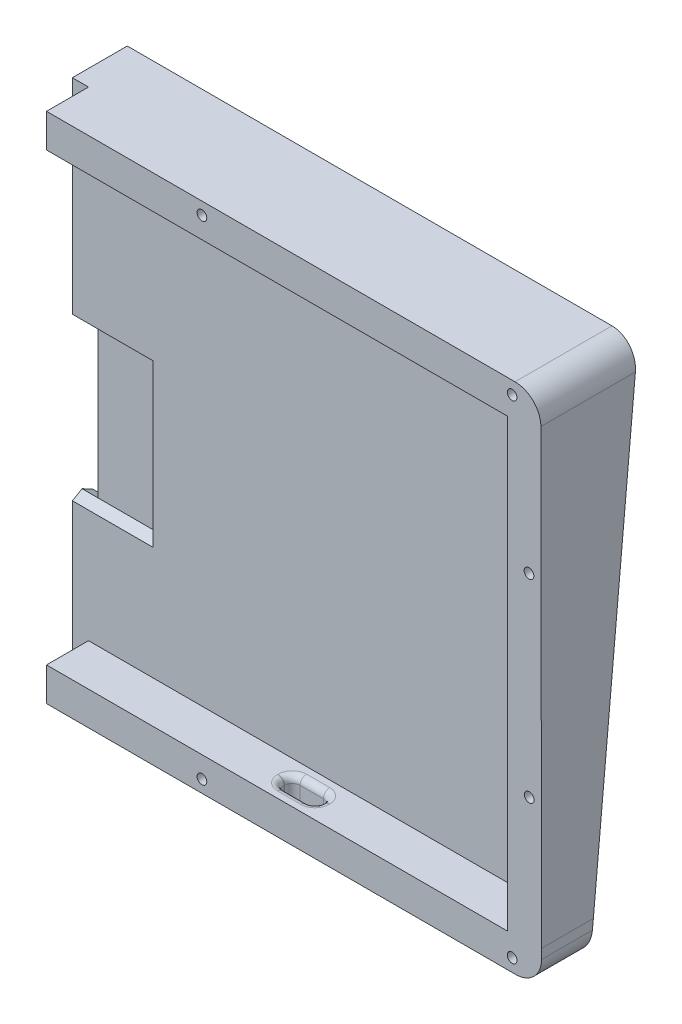
from build123d import *

# Parameters (mm, degrees)
EXTRUDE_1_DEPTH      = 30
SKETCH_2_R           = 1.5
CUT_EXTRUDE_1_DEPTH  = 5
CUT_EXTRUDE_4_DEPTH  = 307
SKETCH_3_W           = 285.26
SKETCH_3_H           = 138.01
CUT_EXTRUDE_5_DEPTH  = 13
SKETCH_12_W          = 40
SKETCH_12_H          = 50
CUT_EXTRUDE_7_DEPTH  = 3
CUT_EXTRUDE_7_DRAFT  = -30
SKETCH_9_W           = 100
SKETCH_9_H           = 80
CUT_EXTRUDE_8_DEPTH  = 3
CUT_EXTRUDE_8_DRAFT  = -30
CUT_EXTRUDE_9_DEPTH  = 11
FILLET_1_R           = 2
CUT_EXTRUDE_10_DEPTH = 11
FILLET_2_R           = 2
FILLET_3_R           = 2
FILLET_4_R           = 2
EXTRUDE_3_DEPTH      = 5
EXTRUDE_4_DEPTH      = 5


with BuildPart() as part:
    # Model → 凸台-拉伸1 (new body)
    with BuildSketch(Plane.XY):
        with BuildLine():
            Line((0, 11), (0, 150.75))
            ThreePointArc((0, 150.75), (2.343145751, 156.406854249), (8, 158.75))
            Line((8, 158.75), (298.011203897, 158.75))
            ThreePointArc((298.011203897, 158.75), (303.664092807, 156.410816811), (306.011196041, 150.761211743))
            Line((306.011196041, 150.761211743), (306.207051361, 11.011211743))
            Line((306.207051361, 11.011211743), (306.207051361, 8))
            ThreePointArc((306.207051361, 8), (303.863905611, 2.343145751), (298.207051361, 0))
            Line((298.207051361, 0), (8, 0))
            ThreePointArc((8, 0), (2.343145751, 2.343145751), (0, 8))
            Line((0, 8), (0, 11))
        make_face()
    extrude(amount=-EXTRUDE_1_DEPTH)

    # 草图2 → 切除-拉伸1 (cut)
    with BuildSketch(Plane.XY):
        with Locations((105.108569936, 3.75)):
            Circle(SKETCH_2_R)
        with Locations((9.108569936, 3.75)):
            Circle(SKETCH_2_R)
        with Locations((201.10846029, 3.817270412)):
            Circle(SKETCH_2_R)
        with Locations((297.108366012, 3.951811323)):
            Circle(SKETCH_2_R)
        with Locations((105.108569936, 155)):
            Circle(SKETCH_2_R)
        with Locations((9.108569936, 155)):
            Circle(SKETCH_2_R)
        with Locations((201.10846029, 154.932729588)):
            Circle(SKETCH_2_R)
        with Locations((297.108366012, 154.798188677)):
            Circle(SKETCH_2_R)
        with Locations((3.75, 109.375)):
            Circle(SKETCH_2_R)
        with Locations((3.75, 49.375)):
            Circle(SKETCH_2_R)
        with Locations((302.318900647, 109.584217456)):
            Circle(SKETCH_2_R)
        with Locations((302.402988717, 49.58427638)):
            Circle(SKETCH_2_R)
    extrude(amount=-CUT_EXTRUDE_1_DEPTH, mode=Mode.SUBTRACT)

    # 草图6 → 切除-拉伸4 (cut)
    with BuildSketch(Plane.ZY):
        Polygon((-30, 158.75), (-30, 0), (-15, 0), align=None)
    extrude(amount=-CUT_EXTRUDE_4_DEPTH, mode=Mode.SUBTRACT)

    # 草图3 → 切除-拉伸5 (cut)
    with BuildSketch(Plane.XY):
        with Locations((153, 79.375)):
            Rectangle(SKETCH_3_W, SKETCH_3_H)
    extrude(amount=-CUT_EXTRUDE_5_DEPTH, mode=Mode.SUBTRACT)


with BuildPart() as cut_extrude_7_tool:
    # 草图12 → 切除-拉伸7 (with draft: the straight prism first)
    with BuildSketch(Plane.XY.offset(-13)):
        with Locations((153, 70.37)):
            Rectangle(SKETCH_12_W, SKETCH_12_H)
    extrude(amount=-CUT_EXTRUDE_7_DEPTH)
    # 切除-拉伸7: the draft: its side faces are tilted about the plane it starts from
    cut_extrude_7_sides = [cut_extrude_7_tool.faces().sort_by_distance(p)[0] for p in [
        (153, 45.37, -14.5),
        (173, 70.37, -14.5),
        (153, 95.37, -14.5),
        (133, 70.37, -14.5),
    ]]
    draft(cut_extrude_7_sides, Plane.XY.offset(-13), CUT_EXTRUDE_7_DRAFT)


with BuildPart() as part_1:
    add(part.part)

    # 切除-拉伸7: cut by cut_extrude_7_tool
    add(cut_extrude_7_tool.part, mode=Mode.SUBTRACT)


with BuildPart() as cut_extrude_8_tool:
    # 草图9 → 切除-拉伸8 (with draft: the straight prism first)
    with BuildSketch(Plane.XY.offset(-13)):
        with Locations((75.37, 88.38)):
            Rectangle(SKETCH_9_W, SKETCH_9_H)
    extrude(amount=-CUT_EXTRUDE_8_DEPTH)
    # 切除-拉伸8: the draft: its side faces are tilted about the plane it starts from
    cut_extrude_8_sides = [cut_extrude_8_tool.faces().sort_by_distance(p)[0] for p in [
        (25.37, 88.38, -14.5),
        (75.37, 48.38, -14.5),
        (125.37, 88.38, -14.5),
        (75.37, 128.38, -14.5),
    ]]
    draft(cut_extrude_8_sides, Plane.XY.offset(-13), CUT_EXTRUDE_8_DRAFT)


with BuildPart() as part_2:
    add(part_1.part)

    # 切除-拉伸8: cut by cut_extrude_8_tool
    add(cut_extrude_8_tool.part, mode=Mode.SUBTRACT)

    # 草图14 → 切除-拉伸9 (cut)
    with BuildSketch(Plane.ZY):
        with BuildLine():
            Line((-5.9, 129.38), (-6.1, 129.38))
            ThreePointArc((-6.1, 129.38), (-7.797056275, 128.677056275), (-8.5, 126.98))
            Line((-8.5, 126.98), (-8.5, 120.78))
            ThreePointArc((-8.5, 120.78), (-7.797056275, 119.082943725), (-6.1, 118.38))
            Line((-6.1, 118.38), (-5.9, 118.38))
            ThreePointArc((-5.9, 118.38), (-4.202943725, 119.082943725), (-3.5, 120.78))
            Line((-3.5, 120.78), (-3.5, 126.98))
            ThreePointArc((-3.5, 126.98), (-4.202943725, 128.677056275), (-5.9, 129.38))
        make_face()
    extrude(amount=-CUT_EXTRUDE_9_DEPTH, mode=Mode.SUBTRACT)

    # 圆角1
    fillet_1_edges = [part_2.edges().sort_by_distance(p)[0] for p in [
        (0, 128.677056275, -7.797056275),
        (0, 129.38, -6),
        (0, 128.677056275, -4.202943725),
        (0, 123.88, -3.5),
        (0, 119.082943725, -4.202943725),
        (0, 118.38, -6),
        (0, 119.082943725, -7.797056275),
        (0, 123.88, -8.5),
    ]]
    fillet(fillet_1_edges, radius=FILLET_1_R)

    # 草图15 → 切除-拉伸10 (cut)
    with BuildSketch(Plane.XZ):
        with BuildLine():
            Line((222.53, -3.959687417), (229.73, -3.959687417))
            ThreePointArc((229.73, -3.959687417), (231.427056275, -4.662631142), (232.13, -6.359687417))
            Line((232.13, -6.359687417), (232.13, -6.559687417))
            ThreePointArc((232.13, -6.559687417), (231.427056275, -8.256743692), (229.73, -8.959687417))
            Line((229.73, -8.959687417), (222.53, -8.959687417))
            ThreePointArc((222.53, -8.959687417), (220.832943725, -8.256743692), (220.13, -6.559687417))
            Line((220.13, -6.559687417), (220.13, -6.359687417))
            ThreePointArc((220.13, -6.359687417), (220.832943725, -4.662631142), (222.53, -3.959687417))
        make_face()
    extrude(amount=-CUT_EXTRUDE_10_DEPTH, mode=Mode.SUBTRACT)

    # 圆角2
    fillet_2_edges = [part_2.edges().sort_by_distance(p)[0] for p in [
        (232.13, 0, -6.459687417),
        (231.427056275, 0, -4.662631142),
        (226.13, 0, -3.959687417),
        (220.832943725, 0, -4.662631142),
        (220.13, 0, -6.459687417),
        (220.832943725, 0, -8.256743692),
        (226.13, 0, -8.959687417),
        (231.427056275, 0, -8.256743692),
    ]]
    fillet(fillet_2_edges, radius=FILLET_2_R)

    # 圆角3
    fillet_3_edges = [part_2.edges().sort_by_distance(p)[0] for p in [
        (10.37, 129.38, -6),
        (10.37, 128.677056275, -4.202943725),
        (10.37, 123.88, -3.5),
        (10.37, 119.082943725, -4.202943725),
        (10.37, 118.38, -6),
        (10.37, 119.082943725, -7.797056275),
        (10.37, 123.88, -8.5),
        (10.37, 128.677056275, -7.797056275),
    ]]
    fillet(fillet_3_edges, radius=FILLET_3_R)

    # 圆角4
    fillet_4_edges = [part_2.edges().sort_by_distance(p)[0] for p in [
        (231.427056275, 10.37, -8.256743692),
        (232.13, 10.37, -6.459687417),
        (231.427056275, 10.37, -4.662631142),
        (226.13, 10.37, -3.959687417),
        (220.832943725, 10.37, -4.662631142),
        (220.13, 10.37, -6.459687417),
        (220.832943725, 10.37, -8.256743692),
        (226.13, 10.37, -8.959687417),
    ]]
    fillet(fillet_4_edges, radius=FILLET_4_R)


with BuildPart() as body_2:
    # Split Bodies 1: the piece on the far side of the plane
    add(part_2.part)
    split(bisect_by=Plane(origin=(153.005601949, 0, 0), x_dir=(0, 0, 1), z_dir=(1, 0, 0)), keep=Keep.BOTTOM)


with BuildPart() as part_3:
    add(part_2.part)

    # Split Bodies 1
    split(bisect_by=Plane(origin=(153.005601949, 0, 0), x_dir=(0, 0, 1), z_dir=(1, 0, 0)), keep=Keep.TOP)

    # 草图19 → 凸台-拉伸3 (add)
    with BuildSketch(Plane.ZY.offset(-153.005601949)):
        Polygon((-19.286929134, 45.37), (-15, 0), (-13, 0), (-13, 10.37), (-13, 45.37), (-16, 47.102050808), align=None)
    extrude(amount=EXTRUDE_3_DEPTH)

    # 草图19<5> → 凸台-拉伸4 (add)
    with BuildSketch(Plane.ZY.offset(-153.005601949)):
        Polygon((-30, 158.75), (-24.011338583, 95.37), (-16, 93.637949192), (-13, 95.37), (-13, 148.38), (-13, 158.75), align=None)
        Polygon((-19.286929134, 45.37), (-15, 0), (-13, 0), (-13, 10.37), (-13, 45.37), (-16, 47.102050808), align=None)
    extrude(amount=EXTRUDE_4_DEPTH)


solid = part_3.part
